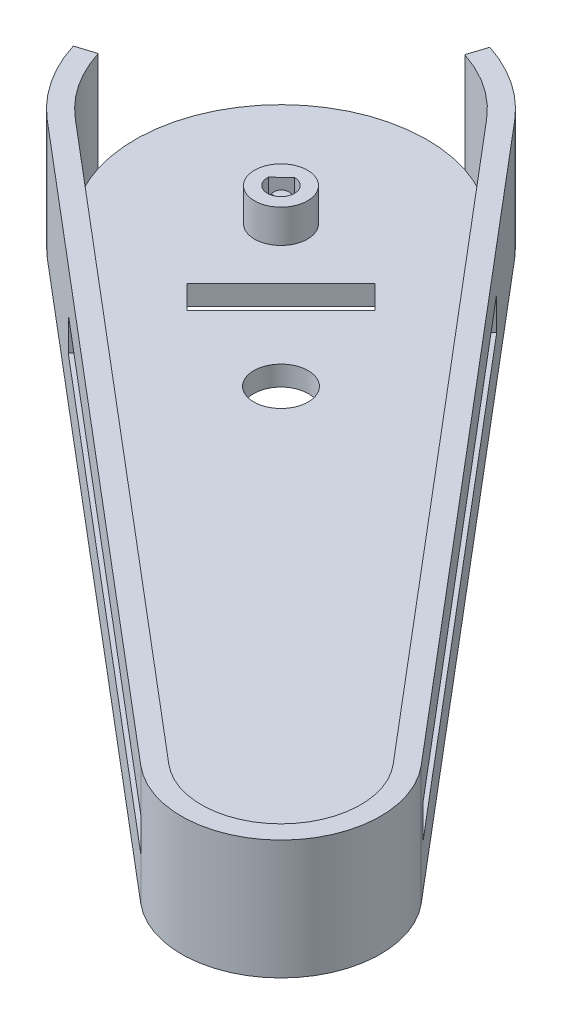
from build123d import *

# Parameters (mm, degrees)
EXTRUDE_2_DEPTH           = 3
SKETCH_4_R                = 2.25
SKETCH_4_R_2              = 2.5
CUT_EXTRUDE_2_DEPTH       = 96.402519291
SKETCH_6_R                = 3.5
CUT_EXTRUDE_3_DEPTH       = 96.402519291
SKETCH_7_R                = 3.5
CUT_EXTRUDE_4_DEPTH       = 96.402519291
CUT_EXTRUDE_5_DEPTH       = 96.402519291
EXTRUDE_4_DEPTH           = 15
EXTRUDE_5_DEPTH           = 3
SKETCH_11_R               = 4.1
CUT_EXTRUDE_6_DEPTH       = 3
SKETCH_13_R               = 3.5
EXTRUDE_6_DEPTH           = 3
SKETCH_14_R               = 2.05
EXTRUDE_7_DEPTH           = 5
EXTRUDE_START             = -5
SKETCH_15_R               = 4
SKETCH_15_R_2             = 2.05
EXTRUDE_8_DEPTH           = 5
CUT_EXTRUDE_7_DEPTH       = 96.878259721
SKETCH_18_R               = 1.397318861
CUT_EXTRUDE_8_DEPTH       = 144.753442506
CUT_EXTRUDE_9_DEPTH       = 97.527927136
CUT_EXTRUDE_9_DEPTH_BACK  = 97.527927136
CUT_EXTRUDE_11_DEPTH      = 110.140706759
CUT_EXTRUDE_11_DEPTH_BACK = 110.140706759
SKETCH_20_W               = 92.736362136
SKETCH_20_H               = 2.6
SKETCH_20_H_2             = 2.5
CUT_EXTRUDE_12_DEPTH      = 5


with BuildPart() as part:
    # 草图2 → 凸台-拉伸2 (new body)
    with BuildSketch(Plane(origin=(0, 0, 0), x_dir=(1, 0, 0), z_dir=(0, 1, 0))):
        with BuildLine():
            Line((-58.569449541, 23.337085947), (32.740581269, -53.879999426))
            ThreePointArc((32.740581269, -53.879999426), (53.033008589, -53.033008589), (53.879999426, -32.740581269))
            Line((53.879999426, -32.740581269), (-23.337085947, 58.569449541))
            ThreePointArc((-23.337085947, 58.569449541), (-60.104076401, 60.104076401), (-58.569449541, 23.337085947))
        make_face()
    extrude(amount=EXTRUDE_2_DEPTH)

    # 草图4 → 切除-拉伸2 (cut, through all)
    with BuildSketch(Plane(origin=(0, 3, 0), x_dir=(1, 0, 0), z_dir=(0, 1, 0))):
        with Locations(Location((-42.426406871, 42.426406871, 0), (0, 0, 270))):
            Circle(SKETCH_4_R)
        with Locations(Location((42.426406871, -42.426406871, 0), (0, 0, 270))):
            Circle(SKETCH_4_R_2)
    extrude(amount=-CUT_EXTRUDE_2_DEPTH, mode=Mode.SUBTRACT)

    # 草图6 → 切除-拉伸3 (cut, through all)
    with BuildSketch(Plane(origin=(0, 3, 0), x_dir=(1, 0, 0), z_dir=(0, 1, 0))):
        with Locations(Location((-42.426406871, 42.426406871, 0), (0, 0, 270))):
            Circle(SKETCH_6_R)
    extrude(amount=-CUT_EXTRUDE_3_DEPTH, mode=Mode.SUBTRACT)

    # 草图7 → 切除-拉伸4 (cut, through all)
    with BuildSketch(Plane(origin=(0, 3, 0), x_dir=(1, 0, 0), z_dir=(0, 1, 0))):
        with Locations(Location((42.426406871, -42.426406871, 0), (0, 0, 270))):
            Circle(SKETCH_7_R)
    extrude(amount=-CUT_EXTRUDE_4_DEPTH, mode=Mode.SUBTRACT)

    # 草图8 → 切除-拉伸5 (cut, through all)
    with BuildSketch(Plane(origin=(0, 3, 0), x_dir=(1, 0, 0), z_dir=(0, 1, 0))):
        Polygon((33.626672858, -22.564710472), (-15.702999665, 25.870376375), (-26.891422763, 12.98046534), (25.218843822, -32.251166492), align=None)
    extrude(amount=-CUT_EXTRUDE_5_DEPTH, mode=Mode.SUBTRACT)

    # 草图9 → 凸台-拉伸4 (add)
    with BuildSketch(Plane(origin=(0, 3, 0), x_dir=(1, 0, 0), z_dir=(0, 1, 0))):
        with BuildLine():
            ThreePointArc((-17.960284018, 47.565359346), (-19.96440182, 53.401757848), (-23.337085947, 58.569449541))
            ThreePointArc((-23.337085947, 58.569449541), (-60.104076401, 60.104076401), (-58.569449541, 23.337085947))
            ThreePointArc((-58.569449541, 23.337085947), (-53.401757848, 19.96440182), (-47.565359346, 17.960284018))
            Line((-47.565359346, 17.960284018), (-56.632284421, 25.627804458))
            ThreePointArc((-56.632284421, 25.627804458), (-57.982756057, 57.982756057), (-25.627804458, 56.632284421))
            Line((-25.627804458, 56.632284421), (-17.960284018, 47.565359346))
        make_face()
        with BuildLine():
            Line((53.879999426, -32.740581269), (-23.337085947, 58.569449541))
            ThreePointArc((-23.337085947, 58.569449541), (-19.96440182, 53.401757848), (-17.960284018, 47.565359346))
            Line((-17.960284018, 47.565359346), (45.777785554, -27.805590857))
            ThreePointArc((45.777785554, -27.805590857), (50.229311839, -29.615681908), (53.879999426, -32.740581269))
        make_face()
        with BuildLine():
            ThreePointArc((-47.565359346, 17.960284018), (-53.401757848, 19.96440182), (-58.569449541, 23.337085947))
            Line((-58.569449541, 23.337085947), (32.740581269, -53.879999426))
            ThreePointArc((32.740581269, -53.879999426), (29.615681908, -50.229311839), (27.805590857, -45.777785554))
            Line((27.805590857, -45.777785554), (-47.565359346, 17.960284018))
        make_face()
        with BuildLine():
            ThreePointArc((57.426406871, -42.426406871), (56.511929373, -37.26907657), (53.879999426, -32.740581269))
            ThreePointArc((53.879999426, -32.740581269), (50.229311839, -29.615681908), (45.777785554, -27.805590857))
            Line((45.777785554, -27.805590857), (51.589280915, -34.67774639))
            ThreePointArc((51.589280915, -34.67774639), (53.694824873, -38.30054263), (54.426406871, -42.426406871))
            ThreePointArc((54.426406871, -42.426406871), (47.47695507, -53.311808237), (34.67774639, -51.589280915))
            Line((34.67774639, -51.589280915), (27.805590857, -45.777785554))
            ThreePointArc((27.805590857, -45.777785554), (29.615681908, -50.229311839), (32.740581269, -53.879999426))
            ThreePointArc((32.740581269, -53.879999426), (48.73959212, -56.033158578), (57.426406871, -42.426406871))
        make_face()
    extrude(amount=EXTRUDE_4_DEPTH)

    # 草图10 → 凸台-拉伸5 (add)
    with BuildSketch(Plane(origin=(0, 3, 0), x_dir=(1, 0, 0), z_dir=(0, 1, 0))):
        Polygon((10.528753113, -10.528753113), (-20.427450775, 20.427450775), (-26.891422763, 12.98046534), (25.218843822, -32.251166492), (28.486536718, -28.486536718), align=None)
        Polygon((-15.702999665, 25.870376375), (-20.427450775, 20.427450775), (10.528753113, -10.528753113), (28.486536718, -28.486536718), (33.626672858, -22.564710472), align=None)
    extrude(amount=-EXTRUDE_5_DEPTH)

    # 草图11 → 切除-拉伸6 (cut)
    with BuildSketch(Plane(origin=(0, 3, 0), x_dir=(1, 0, 0), z_dir=(0, 1, 0))):
        with Locations(Location((-21.213203436, 21.213203436, 0), (0, 0, 270))):
            Circle(SKETCH_11_R)
    extrude(amount=-CUT_EXTRUDE_6_DEPTH, mode=Mode.SUBTRACT)

    # 草图13 → 凸台-拉伸6 (add)
    with BuildSketch(Plane(origin=(0, 3, 0), x_dir=(1, 0, 0), z_dir=(0, 1, 0))):
        with Locations((-42.426406871, 42.426406871)):
            Circle(SKETCH_13_R)
    extrude(amount=-EXTRUDE_6_DEPTH)

    # 草图14 → 凸台-拉伸7 (add)
    with BuildSketch(Plane(origin=(0, 3, 0), x_dir=(1, 0, 0), z_dir=(0, 1, 0))):
        with Locations(Location((-42.426406871, 42.426406871, 0), (0, 0, 270))):
            Circle(SKETCH_14_R)
    extrude(amount=EXTRUDE_7_DEPTH)

    # 草图15 → 凸台-拉伸8 (add)
    with BuildSketch(Plane(origin=(0, 8, 0), x_dir=(1, 0, 0), z_dir=(0, 1, 0)).offset(EXTRUDE_START)):
        with Locations(Location((-42.426406871, 42.426406871, 0), (0, 0, 270))):
            Circle(SKETCH_15_R)
        with Locations((-42.426406871, 42.426406871)):
            Circle(SKETCH_15_R_2, mode=Mode.SUBTRACT)
    extrude(amount=EXTRUDE_8_DEPTH)

    # 草图17 → 切除-拉伸7 (cut, through all)
    with BuildSketch(Plane(origin=(0, 8, 0), x_dir=(1, 0, 0), z_dir=(0, 1, 0))):
        with BuildLine():
            Line((-42.409215342, 44.476334785), (-43.439595085, 43.532503451))
            Line((-43.439595085, 43.532503451), (-44.469974827, 42.588672118))
            ThreePointArc((-44.469974827, 42.588672118), (-42.507603209, 40.378015513), (-40.376406871, 42.426406871))
            ThreePointArc((-40.376406871, 42.426406871), (-40.970772536, 43.869884853), (-42.409215342, 44.476334785))
        make_face()
    extrude(amount=-CUT_EXTRUDE_7_DEPTH, mode=Mode.SUBTRACT)

    # 草图18 → 切除-拉伸8 (cut, through all)
    with BuildSketch(Plane(origin=(-41.501827845, 0, -45.307504805), x_dir=(0.7373977200215518, 0, -0.6754588088899406), z_dir=(0.6754588088899406, 0, 0.7373977200215518))):
        with Locations((-2.627845445, 4.953208644)):
            Circle(SKETCH_18_R)
    extrude(amount=-CUT_EXTRUDE_8_DEPTH, mode=Mode.SUBTRACT)

    # 草图19 → 切除-拉伸9 (cut, two sides: drawn at the far end of the back side and taken through both)
    with BuildSketch(Plane(origin=(0, 3, 0), x_dir=(1, 0, 0), z_dir=(0, 1, 0)).offset(-CUT_EXTRUDE_9_DEPTH_BACK)):
        with BuildLine():
            Line((-66.29326799, 34.985107232), (-63.429244656, 35.878063189))
            ThreePointArc((-63.429244656, 35.878063189), (-57.900931168, 58.064152802), (-35.65805893, 63.35938244))
            Line((-35.65805893, 63.35938244), (-34.735102393, 66.213879108))
            ThreePointArc((-34.735102393, 66.213879108), (-60.011093572, 60.196572701), (-66.29326799, 34.985107232))
        make_face()
    extrude(amount=CUT_EXTRUDE_9_DEPTH + CUT_EXTRUDE_9_DEPTH_BACK, mode=Mode.SUBTRACT)

    # 草图20 → 切除-拉伸11 (cut, two sides: drawn at the far end of the back side and taken through both)
    with BuildSketch(Plane(origin=(-12.914434136, 0, 15.27145674), x_dir=(0.7635728369858691, 0, 0.6457217067881111), z_dir=(-0.6457217067881111, 0, 0.7635728369858691)).offset(-CUT_EXTRUDE_11_DEPTH_BACK)):
        with Locations((13.423122648, 10.3)):
            Rectangle(SKETCH_20_W, SKETCH_20_H)
        with Locations((13.423122648, 7.75)):
            Rectangle(SKETCH_20_W, SKETCH_20_H_2)
    extrude(amount=CUT_EXTRUDE_11_DEPTH + CUT_EXTRUDE_11_DEPTH_BACK, mode=Mode.SUBTRACT)

    # 草图23 → 切除-拉伸12 (cut)
    with BuildSketch(Plane(origin=(0, 3, 0), x_dir=(1, 0, 0), z_dir=(0, 1, 0))):
        Polygon((-34.648232278, 34.648232278), (-31.112698372, 31.112698372), (-24.04163056, 38.183766184), (-27.577164466, 41.71930009), align=None)
        Polygon((-38.192264962, 24.033131782), (-31.112698372, 31.112698372), (-34.648232278, 34.648232278), (-41.71930009, 27.577164466), align=None)
    extrude(amount=-CUT_EXTRUDE_12_DEPTH, mode=Mode.SUBTRACT)


solid = part.part
